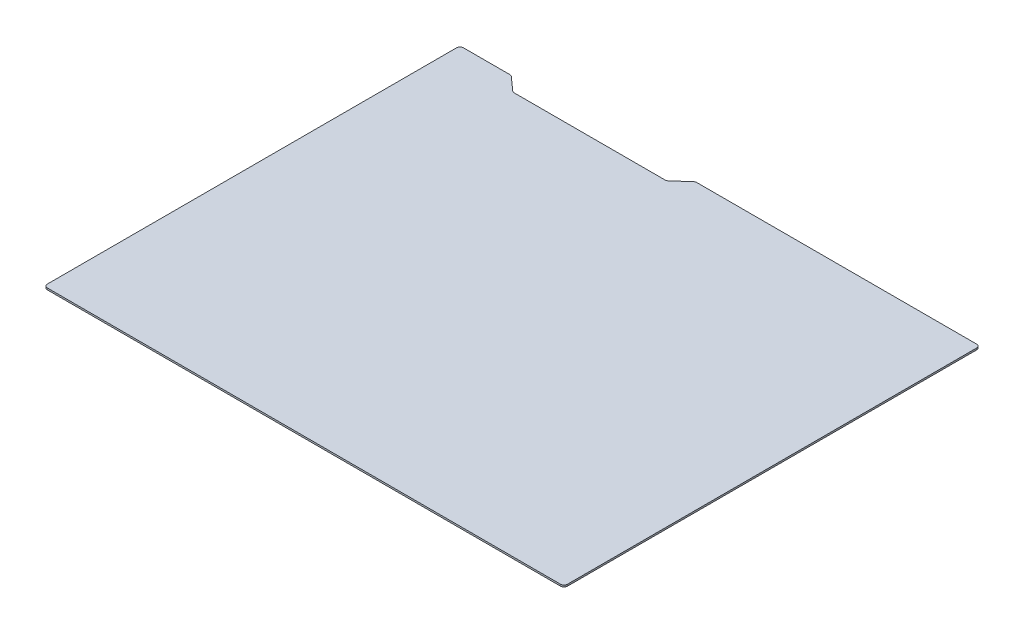
from build123d import *

# Parameters (mm, degrees)
BOSS_EXTRUDE1_DEPTH = 1
FILLET1_R           = 2
FILLET2_R           = 2


with BuildPart() as part:
    # Sketch1 → Boss-Extrude1 (new body)
    with BuildSketch(Plane(origin=(0, 0, 0), x_dir=(1, 0, 0), z_dir=(0, 1, 0))):
        Polygon((-152.4, 121.92), (-152.4, -121.92), (152.4, -121.92), (152.4, 121.92), (-14.4, 121.92), (-23.4, 113.92), (-113.4, 113.92), (-122.4, 121.92), align=None)
    extrude(amount=BOSS_EXTRUDE1_DEPTH)

    # Fillet1
    fillet1_edges = [part.edges().sort_by_distance(p)[0] for p in [
        (-122.4, 0.5, -121.92),
        (-113.4, 0.5, -113.92),
        (-23.4, 0.5, -113.92),
        (-14.4, 0.5, -121.92),
    ]]
    fillet(fillet1_edges, radius=FILLET1_R)

    # Fillet2
    fillet2_edges = [part.edges().sort_by_distance(p)[0] for p in [
        (152.4, 0.5, 121.92),
        (-152.4, 0.5, 121.92),
        (-152.4, 0.5, -121.92),
        (152.4, 0.5, -121.92),
    ]]
    fillet(fillet2_edges, radius=FILLET2_R)


solid = part.part
